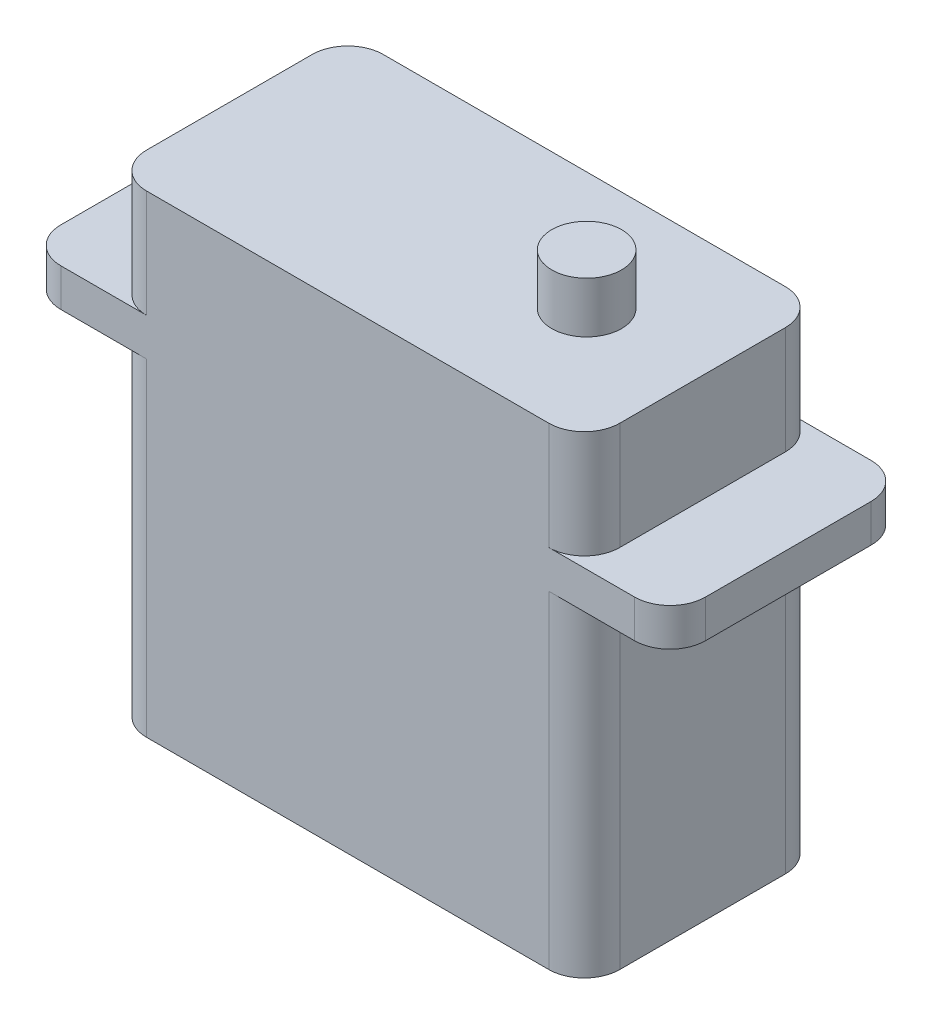
from build123d import *

# Parameters (mm, degrees)
SKETCH1_W           = 40
SKETCH1_H           = 20
BOSS_EXTRUDE1_DEPTH = 40
SKETCH2_W           = 54.5
SKETCH2_H           = 3.2
BOSS_EXTRUDE2_DEPTH = 20
FILLET1_R           = 3
SKETCH3_R           = 2.95
BOSS_EXTRUDE3_DEPTH = 4.3


with BuildPart() as part:
    # Sketch1 → Boss-Extrude1 (new body)
    with BuildSketch(Plane(origin=(0, 0, 0), x_dir=(1, 0, 0), z_dir=(0, 1, 0))):
        Rectangle(SKETCH1_W, SKETCH1_H)
    extrude(amount=BOSS_EXTRUDE1_DEPTH)

    # Sketch2 → Boss-Extrude2 (add)
    with BuildSketch(Plane.XY.offset(10)):
        with Locations((0, 29.3)):
            Rectangle(SKETCH2_W, SKETCH2_H)
    extrude(amount=-BOSS_EXTRUDE2_DEPTH)

    # Fillet1
    fillet1_edges = [part.edges().sort_by_distance(p)[0] for p in [
        (20, 13.85, 10),
        (-20, 13.85, 10),
        (-20, 13.85, -10),
        (20, 13.85, -10),
        (27.25, 29.3, 10),
        (27.25, 29.3, -10),
        (-27.25, 29.3, -10),
        (-27.25, 29.3, 10),
        (20, 35.45, 10),
        (-20, 35.45, 10),
        (-20, 35.45, -10),
        (20, 35.45, -10),
    ]]
    fillet(fillet1_edges, radius=FILLET1_R)

    # Sketch3 → Boss-Extrude3 (add)
    with BuildSketch(Plane(origin=(0, 40, 0), x_dir=(1, 0, 0), z_dir=(0, 1, 0))):
        with Locations(Location((10.2, 0, 0), (0, 0, 90))):
            Circle(SKETCH3_R)
    extrude(amount=BOSS_EXTRUDE3_DEPTH)


solid = part.part
